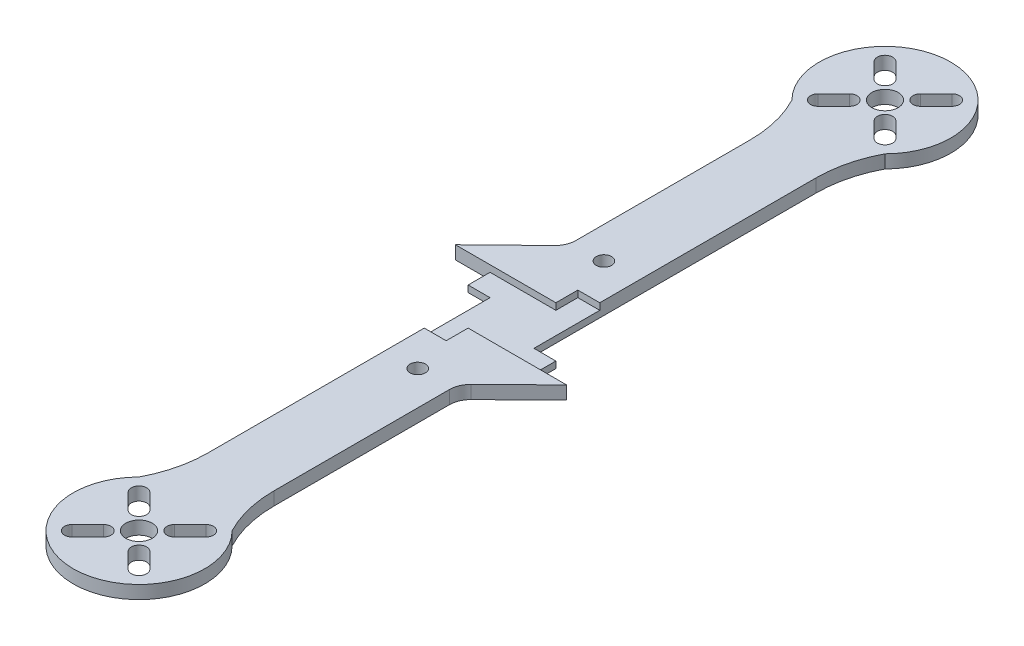
from build123d import *

# Parameters (mm, degrees)
SKETCH1_R            = 3
SKETCH1_R_2          = 1.75
SKETCH1_R_3          = 1.5
BOSS_EXTRUDE2_DEPTH  = 3
SKETCH3_W            = 15.09800494
SKETCH3_H            = 15
CUT_EXTRUDE1_DEPTH   = 1.5
BOSS_EXTRUDE5_DEPTH  = 1.5
SKETCH5_W            = 5
SKETCH5_H            = 5
CUT_EXTRUDE2_DEPTH   = 1.5
BOSS_EXTRUDE7_DEPTH  = 3
SKETCH11_W           = 5
SKETCH11_H           = 5
BOSS_EXTRUDE11_DEPTH = 1.5
BOSS_EXTRUDE13_START = -3
SKETCH13_R           = 1.5
BOSS_EXTRUDE13_DEPTH = 3
SKETCH14_R           = 1.5
CUT_EXTRUDE6_DEPTH   = 103.094396255
SKETCH15_R           = 1.75
BOSS_EXTRUDE14_DEPTH = 3
SKETCH16_R           = 1.75
CUT_EXTRUDE7_DEPTH   = 103.094396255
SKETCH17_R           = 2.254560192
SKETCH17_R_2         = 2.966312922
SKETCH17_R_3         = 2.636452531
SKETCH17_R_4         = 1.99649084
SKETCH17_R_5         = 2.524996951
SKETCH17_R_6         = 3.313056584
SKETCH17_R_7         = 2.262213741
SKETCH17_R_8         = 2.353292134
BOSS_EXTRUDE15_DEPTH = 3
SKETCH19_R           = 1.75
CUT_EXTRUDE10_DEPTH  = 10
CUT_EXTRUDE11_DEPTH  = 10


with BuildPart() as part:
    # Sketch1 → Boss-Extrude2 (new body)
    with BuildSketch(Plane(origin=(0, 0, 0), x_dir=(1, 0, 0), z_dir=(0, 1, 0))):
        with BuildLine():
            Line((-7.45099753, -61.780902979), (-7.45099753, 61.780902979))
            ThreePointArc((-7.45099753, 61.780902979), (-8.239083338, 68.275631842), (-10.557599248, 74.393398282))
            ThreePointArc((-10.557599248, 74.393398282), (0.04900247, 100), (10.655604188, 74.393398282))
            ThreePointArc((10.655604188, 74.393398282), (8.337088278, 68.275631842), (7.54900247, 61.780902979))
            Line((7.54900247, 61.780902979), (7.54900247, -61.780902979))
            ThreePointArc((7.54900247, -61.780902979), (8.337088278, -68.275631842), (10.655604188, -74.393398282))
            ThreePointArc((10.655604188, -74.393398282), (0.04900247, -100), (-10.557599248, -74.393398282))
            ThreePointArc((-10.557599248, -74.393398282), (-8.239083338, -68.275631842), (-7.45099753, -61.780902979))
        make_face()
        with Locations(Location((0.04900247, 85, 0), (0, 0, 270))):
            Circle(SKETCH1_R, mode=Mode.SUBTRACT)
        with Locations(Location((-6.668511951, 91.717514421, 0), (0, 0, 270))):
            Circle(SKETCH1_R_2, mode=Mode.SUBTRACT)
        with Locations(Location((-5.607851779, 79.343145751, 0), (0, 0, 270))):
            Circle(SKETCH1_R_2, mode=Mode.SUBTRACT)
        with Locations(Location((5.70585672, 90.656854249, 0), (0, 0, 270))):
            Circle(SKETCH1_R_2, mode=Mode.SUBTRACT)
        with Locations(Location((6.766516891, 78.282485579, 0), (0, 0, 270))):
            Circle(SKETCH1_R_2, mode=Mode.SUBTRACT)
        with Locations(Location((0, 20, 0), (0, 0, 270))):
            Circle(SKETCH1_R_3, mode=Mode.SUBTRACT)
        with Locations(Location((5.70585672, -90.656854249, 0), (0, 0, 90))):
            Circle(SKETCH1_R_2, mode=Mode.SUBTRACT)
        with Locations(Location((-6.668511951, -91.717514421, 0), (0, 0, 90))):
            Circle(SKETCH1_R_2, mode=Mode.SUBTRACT)
        with Locations(Location((0.04900247, -85, 0), (0, 0, 90))):
            Circle(SKETCH1_R, mode=Mode.SUBTRACT)
        with Locations(Location((6.766516891, -78.282485579, 0), (0, 0, 90))):
            Circle(SKETCH1_R_2, mode=Mode.SUBTRACT)
        with Locations(Location((-5.607851779, -79.343145751, 0), (0, 0, 90))):
            Circle(SKETCH1_R_2, mode=Mode.SUBTRACT)
        with Locations(Location((0, -20, 0), (0, 0, 90))):
            Circle(SKETCH1_R_3, mode=Mode.SUBTRACT)
    extrude(amount=BOSS_EXTRUDE2_DEPTH)

    # Sketch3 → Cut-Extrude1 (cut)
    with BuildSketch(Plane(origin=(0, 3, 0), x_dir=(1, 0, 0), z_dir=(0, 1, 0))):
        Rectangle(SKETCH3_W, SKETCH3_H)
    extrude(amount=-CUT_EXTRUDE1_DEPTH, mode=Mode.SUBTRACT)

    # Sketch4 → Boss-Extrude5 (add, symmetric)
    with BuildSketch(Plane(origin=(0, 1.5, 0), x_dir=(1, 0, 0), z_dir=(0, 1, 0))):
        Polygon((7.54900247, -7.5), (19.98054828, -7.5), (7.54900247, -19.723921291), align=None)
        Polygon((-7.208608823, 7.5), (-20.353519271, 7.5), (-7.208608823, 20.276078709), align=None)
    extrude(amount=BOSS_EXTRUDE5_DEPTH, both=True)

    # Sketch5 → Cut-Extrude2 (cut)
    with BuildSketch(Plane(origin=(0, 3, 0), x_dir=(1, 0, 0), z_dir=(0, 1, 0))):
        with Locations((5.04900247, 10)):
            Rectangle(SKETCH5_W, SKETCH5_H)
        with Locations((-4.95099753, -10)):
            Rectangle(SKETCH5_W, SKETCH5_H)
    extrude(amount=-CUT_EXTRUDE2_DEPTH, mode=Mode.SUBTRACT)

    # Sketch6 → Boss-Extrude7 (add)
    with BuildSketch(Plane(origin=(0, 3, 0), x_dir=(1, 0, 0), z_dir=(0, 1, 0))):
        with BuildLine():
            Line((7.54900247, -19.723921291), (8.975074609, -18.321666587))
            ThreePointArc((8.975074609, -18.321666587), (7.919938782, -19.879401108), (7.54900247, -21.723921291))
            Line((7.54900247, -21.723921291), (7.54900247, -19.723921291))
        make_face()
        with BuildLine():
            Line((-7.45099753, 20.040491163), (-8.885188865, 18.646541661))
            ThreePointArc((-8.885188865, 18.646541661), (-7.824264446, 20.198223674), (-7.45099753, 22.040491163))
            Line((-7.45099753, 22.040491163), (-7.45099753, 20.040491163))
        make_face()
    extrude(amount=-BOSS_EXTRUDE7_DEPTH)

    # Sketch11 → Boss-Extrude11 (add)
    with BuildSketch(Plane(origin=(0, 1.5, 0), x_dir=(1, 0, 0), z_dir=(0, 1, 0))):
        with Locations((10.04900247, -5)):
            Rectangle(SKETCH11_W, SKETCH11_H)
        with Locations((-9.95099753, 5)):
            Rectangle(SKETCH11_W, SKETCH11_H)
    extrude(amount=-BOSS_EXTRUDE11_DEPTH)

    # Sketch13 → Boss-Extrude13 (add)
    with BuildSketch(Plane(origin=(0, 3, 0), x_dir=(1, 0, 0), z_dir=(0, 1, 0)).offset(BOSS_EXTRUDE13_START)):
        with Locations((0, -20)):
            Circle(SKETCH13_R)
        with Locations((0, 20)):
            Circle(SKETCH13_R)
    extrude(amount=BOSS_EXTRUDE13_DEPTH)

    # Sketch14 → Cut-Extrude6 (cut, through all)
    with BuildSketch(Plane(origin=(0, 3, 0), x_dir=(1, 0, 0), z_dir=(0, 1, 0))):
        with Locations(Location((-0.220863586, -21.21320344, 0), (0, 0, 270))):
            Circle(SKETCH14_R)
        with Locations(Location((-0.220863586, 21.2132, 0), (0, 0, 270))):
            Circle(SKETCH14_R)
    extrude(amount=-CUT_EXTRUDE6_DEPTH, mode=Mode.SUBTRACT)

    # Sketch15 → Boss-Extrude14 (add, through all)
    with BuildSketch(Plane(origin=(0, 3, 0), x_dir=(1, 0, 0), z_dir=(0, 1, 0))):
        with Locations((-5.607851779, 79.343145751)):
            Circle(SKETCH15_R)
        with Locations((6.766516891, 78.282485579)):
            Circle(SKETCH15_R)
        with Locations((-6.668511951, 91.717514421)):
            Circle(SKETCH15_R)
        with Locations((5.70585672, 90.656854249)):
            Circle(SKETCH15_R)
    extrude(amount=-BOSS_EXTRUDE14_DEPTH)

    # Sketch16 → Cut-Extrude7 (cut, through all)
    with BuildSketch(Plane(origin=(0, 3, 0), x_dir=(1, 0, 0), z_dir=(0, 1, 0))):
        with Locations(Location((-6.668511951, 78.282485579, 0), (0, 0, 270))):
            Circle(SKETCH16_R)
        with Locations(Location((5.70585672, 79.343145751, 0), (0, 0, 270))):
            Circle(SKETCH16_R)
        with Locations(Location((6.766516891, 91.717514421, 0), (0, 0, 270))):
            Circle(SKETCH16_R)
        with Locations(Location((-5.610118231, 90.659120701, 0), (0, 0, 270))):
            Circle(SKETCH16_R)
    extrude(amount=-CUT_EXTRUDE7_DEPTH, mode=Mode.SUBTRACT)

    # Sketch17 → Boss-Extrude15 (add)
    with BuildSketch(Plane(origin=(0, 3, 0), x_dir=(1, 0, 0), z_dir=(0, 1, 0))):
        with Locations((5.70585672, 79.343145751)):
            Circle(SKETCH17_R)
        with Locations((-6.668511951, 78.282485579)):
            Circle(SKETCH17_R_2)
        with Locations((-5.610118231, 90.659120701)):
            Circle(SKETCH17_R_3)
        with Locations((6.766516891, 91.717514421)):
            Circle(SKETCH17_R_4)
        with Locations((-6.668511951, -91.717514421)):
            Circle(SKETCH17_R_5)
        with Locations((-5.607851779, -79.343145751)):
            Circle(SKETCH17_R_6)
        with Locations((6.766516891, -78.282485579)):
            Circle(SKETCH17_R_7)
        with Locations((5.70585672, -90.656854249)):
            Circle(SKETCH17_R_8)
    extrude(amount=-BOSS_EXTRUDE15_DEPTH)

    # Sketch19 → Cut-Extrude10 (cut)
    with BuildSketch(Plane(origin=(0, 3, 0), x_dir=(1, 0, 0), z_dir=(0, 1, 0))):
        with Locations(Location((-0.220863586, -21.21320344, 0), (0, 0, 270))):
            Circle(SKETCH19_R)
        with Locations(Location((-0.220863586, 21.2132, 0), (0, 0, 270))):
            Circle(SKETCH19_R)
    extrude(amount=-CUT_EXTRUDE10_DEPTH, mode=Mode.SUBTRACT)

    # Sketch18 → Cut-Extrude11 (cut)
    with BuildSketch(Plane(origin=(0, 3, 0), x_dir=(1, 0, 0), z_dir=(0, 1, 0))):
        with BuildLine():
            Line((8.893452608, -93.844450138), (2.877429595, -87.828427125))
            ThreePointArc((2.877429595, -87.828427125), (2.364866462, -89.065863992), (2.877429595, -90.303300859))
            Line((2.877429595, -90.303300859), (6.418578874, -93.844450138))
            ThreePointArc((6.418578874, -93.844450138), (7.656015741, -94.357013271), (8.893452608, -93.844450138))
        make_face()
        with BuildLine():
            ThreePointArc((5.352303329, -87.828427125), (4.114866462, -87.315863992), (2.877429595, -87.828427125))
            Line((2.877429595, -87.828427125), (8.893452608, -93.844450138))
            ThreePointArc((8.893452608, -93.844450138), (9.406015741, -92.607013271), (8.893452608, -91.369576404))
            Line((8.893452608, -91.369576404), (5.352303329, -87.828427125))
        make_face()
        with BuildLine():
            Line((8.893452608, -76.155549862), (2.877429595, -82.171572875))
            ThreePointArc((2.877429595, -82.171572875), (4.114866462, -82.684136008), (5.352303329, -82.171572875))
            Line((5.352303329, -82.171572875), (8.893452608, -78.630423596))
            ThreePointArc((8.893452608, -78.630423596), (9.406015741, -77.392986729), (8.893452608, -76.155549862))
        make_face()
        with BuildLine():
            ThreePointArc((2.877429595, -79.696699141), (2.364866462, -80.934136008), (2.877429595, -82.171572875))
            Line((2.877429595, -82.171572875), (8.893452608, -76.155549862))
            ThreePointArc((8.893452608, -76.155549862), (7.656015741, -75.642986729), (6.418578874, -76.155549862))
            Line((6.418578874, -76.155549862), (2.877429595, -79.696699141))
        make_face()
        with BuildLine():
            Line((-8.795447668, -91.369576404), (-5.254298389, -87.828427125))
            ThreePointArc((-5.254298389, -87.828427125), (-2.779424655, -87.828427125), (-2.779424655, -90.303300859))
            Line((-2.779424655, -90.303300859), (-6.320573934, -93.844450138))
            ThreePointArc((-6.320573934, -93.844450138), (-8.795447668, -93.844450138), (-8.795447668, -91.369576404))
        make_face()
        with BuildLine():
            ThreePointArc((-5.254298389, -82.171572875), (-4.016861522, -82.684136008), (-2.779424655, -82.171572875))
            Line((-2.779424655, -82.171572875), (-8.795447668, -76.155549862))
            ThreePointArc((-8.795447668, -76.155549862), (-9.308010801, -77.392986729), (-8.795447668, -78.630423596))
            Line((-8.795447668, -78.630423596), (-5.254298389, -82.171572875))
        make_face()
        with BuildLine():
            Line((-8.795447668, -76.155549862), (-2.779424655, -82.171572875))
            ThreePointArc((-2.779424655, -82.171572875), (-2.266861522, -80.934136008), (-2.779424655, -79.696699141))
            Line((-2.779424655, -79.696699141), (-6.320573934, -76.155549862))
            ThreePointArc((-6.320573934, -76.155549862), (-7.558010801, -75.642986729), (-8.795447668, -76.155549862))
        make_face()
        with BuildLine():
            ThreePointArc((-2.779424655, 90.303300859), (-2.779424655, 87.828427125), (-5.254298389, 87.828427125))
            Line((-5.254298389, 87.828427125), (-8.795447668, 91.369576404))
            ThreePointArc((-8.795447668, 91.369576404), (-8.795447668, 93.844450138), (-6.320573934, 93.844450138))
            Line((-6.320573934, 93.844450138), (-2.779424655, 90.303300859))
        make_face()
        with BuildLine():
            Line((8.893452608, 91.369576404), (5.352303329, 87.828427125))
            ThreePointArc((5.352303329, 87.828427125), (2.877429595, 87.828427125), (2.877429595, 90.303300859))
            Line((2.877429595, 90.303300859), (6.418578874, 93.844450138))
            ThreePointArc((6.418578874, 93.844450138), (8.893452608, 93.844450138), (8.893452608, 91.369576404))
        make_face()
        with BuildLine():
            ThreePointArc((2.877429595, 79.696699141), (2.877429595, 82.171572875), (5.352303329, 82.171572875))
            Line((5.352303329, 82.171572875), (8.893452608, 78.630423596))
            ThreePointArc((8.893452608, 78.630423596), (8.893452608, 76.155549862), (6.418578874, 76.155549862))
            Line((6.418578874, 76.155549862), (2.877429595, 79.696699141))
        make_face()
        with BuildLine():
            Line((-8.795447668, 78.630423596), (-5.254298389, 82.171572875))
            ThreePointArc((-5.254298389, 82.171572875), (-2.779424655, 82.171572875), (-2.779424655, 79.696699141))
            Line((-2.779424655, 79.696699141), (-6.320573934, 76.155549862))
            ThreePointArc((-6.320573934, 76.155549862), (-8.795447668, 76.155549862), (-8.795447668, 78.630423596))
        make_face()
    extrude(amount=-CUT_EXTRUDE11_DEPTH, mode=Mode.SUBTRACT)


solid = part.part
